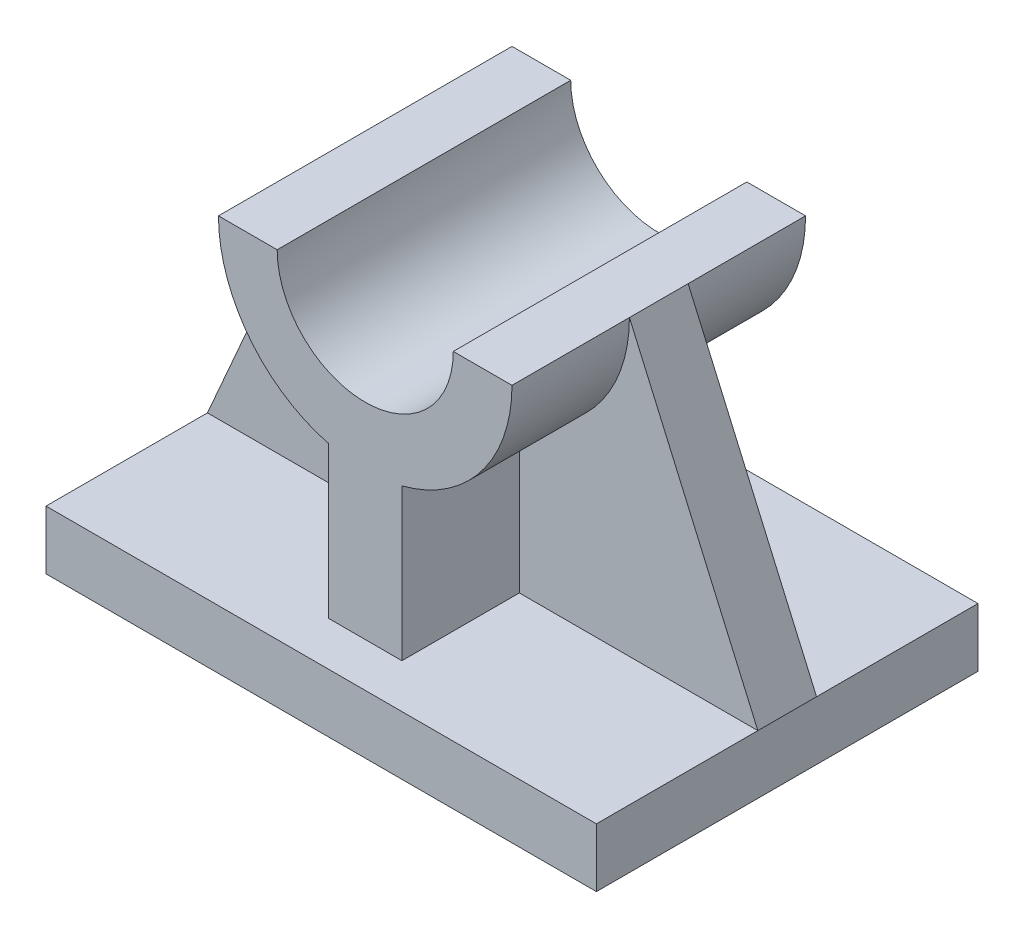
from build123d import *

# Parameters (mm, degrees)
BOSS_EXTRUDE1_DEPTH = 26
BOSS_EXTRUDE2_DEPTH = 20
BOSS_EXTRUDE3_DEPTH = 4


with BuildPart() as part:
    # Sketch1 → Boss-Extrude1 (new, symmetric)
    with BuildSketch(Plane.XY):
        Polygon((37.5, 0), (37.5, 8), (5, 8), (-5, 8), (-37.5, 8), (-37.5, 0), align=None)
    extrude(amount=BOSS_EXTRUDE1_DEPTH, both=True)

    # Sketch1<3> → Boss-Extrude2 (add, symmetric)
    with BuildSketch(Plane.XY):
        with BuildLine():
            ThreePointArc((5, 28.635083269), (15.811388301, 35.752551286), (20, 48))
            Line((20, 48), (12, 48))
            ThreePointArc((12, 48), (0, 36), (-12, 48))
            Line((-12, 48), (-20, 48))
            ThreePointArc((-20, 48), (-15.811388301, 35.752551286), (-5, 28.635083269))
            Line((-5, 28.635083269), (-5, 8))
            Line((-5, 8), (5, 8))
            Line((5, 8), (5, 28.635083269))
        make_face()
    extrude(amount=BOSS_EXTRUDE2_DEPTH, both=True)

    # Sketch1<4> → Boss-Extrude3 (add, symmetric)
    with BuildSketch(Plane.XY):
        with BuildLine():
            Line((37.5, 8), (20, 48))
            ThreePointArc((20, 48), (15.811388301, 35.752551286), (5, 28.635083269))
            Line((5, 28.635083269), (5, 8))
            Line((5, 8), (37.5, 8))
        make_face()
        with BuildLine():
            Line((-37.5, 8), (-5, 8))
            Line((-5, 8), (-5, 28.635083269))
            ThreePointArc((-5, 28.635083269), (-15.811388301, 35.752551286), (-20, 48))
            Line((-20, 48), (-37.5, 8))
        make_face()
    extrude(amount=BOSS_EXTRUDE3_DEPTH, both=True)


solid = part.part
